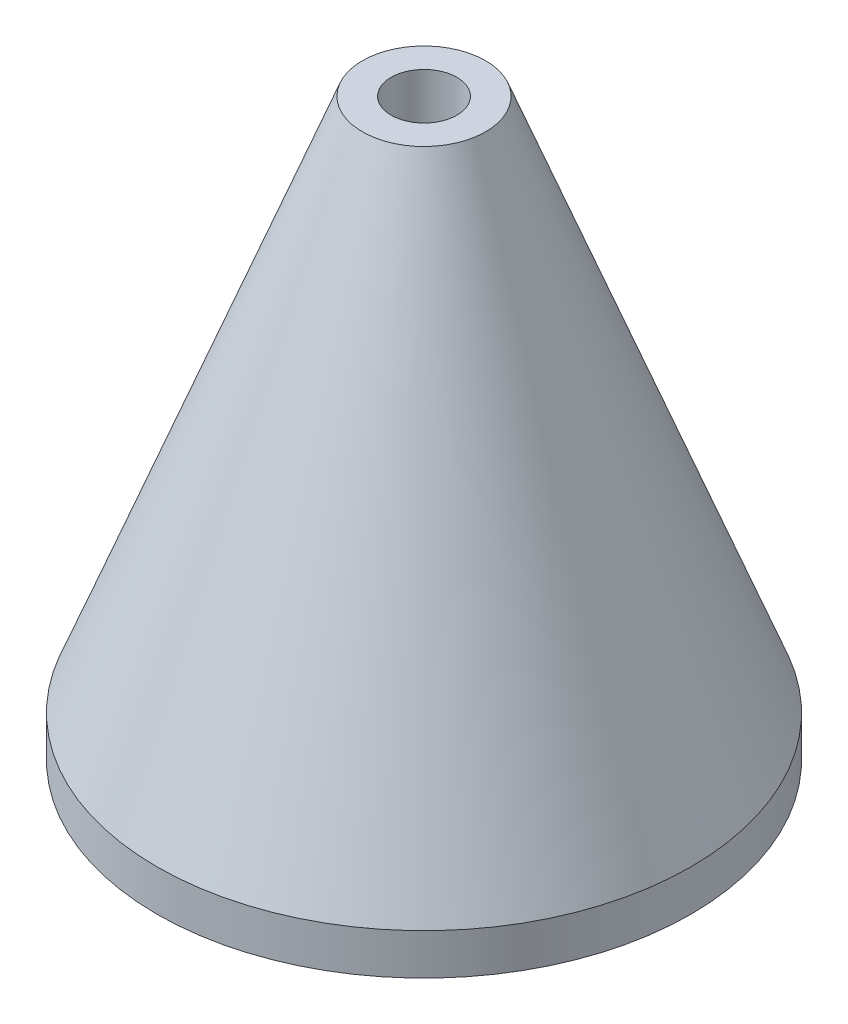
from build123d import *

# Parameters (mm, degrees)
ODEBRAT_VYSUNUT_M2_DEPTH      = 84.740671122
ODEBRAT_VYSUNUT_M2_DEPTH_BACK = 84.740671122
SKICA4_R                      = 2.1
ODEBRAT_VYSUNUT_M3_DEPTH      = 84.740671122
ODEBRAT_VYSUNUT_M3_DEPTH_BACK = 46
SKICA6_R                      = 4
ZKOSEN_1_SIZE                 = 0.5


with BuildPart() as part:
    # Skica1 → Rotovat1 (revolve)
    with BuildSketch(Plane.XY, mode=Mode.PRIVATE) as rotovat1_sk:
        Polygon((0, 0), (32.5, 0), (32.5, 5), (7.5, 70), (0, 70), align=None)
    revolve(rotovat1_sk.sketch.rotate(Axis((0, 0, 0), (0, -1, 0)), 90), axis=Axis((0, 0, 0), (0, -1, 0)))

    # Skica4 → Odebrat vysunutím2 (cut, two sides: drawn at the far end of the back side and taken through both)
    with BuildSketch(Plane(origin=(0, 70, 0), x_dir=(1, 0, 0), z_dir=(0, 1, 0)).offset(-ODEBRAT_VYSUNUT_M2_DEPTH_BACK)):
        with Locations(Location((0, 0, 0), (0, 0, 270))):
            Circle(SKICA4_R)
    extrude(amount=ODEBRAT_VYSUNUT_M2_DEPTH + ODEBRAT_VYSUNUT_M2_DEPTH_BACK, mode=Mode.SUBTRACT)

    # Skica6 → Odebrat vysunutím3 (cut, two sides: drawn at the far end of the back side and taken through both)
    with BuildSketch(Plane(origin=(0, 70, 0), x_dir=(1, 0, 0), z_dir=(0, 1, 0)).offset(-ODEBRAT_VYSUNUT_M3_DEPTH_BACK)):
        with Locations(Location((0, 0, 0), (0, 0, 90))):
            Circle(SKICA6_R)
    extrude(amount=ODEBRAT_VYSUNUT_M3_DEPTH + ODEBRAT_VYSUNUT_M3_DEPTH_BACK, mode=Mode.SUBTRACT)

    # Zkosení1
    zkosen_1_edges = [part.edges().sort_by_distance(p)[0] for p in [
        (0, 24, -2.1),
    ]]
    chamfer(zkosen_1_edges, length=ZKOSEN_1_SIZE)


solid = part.part
